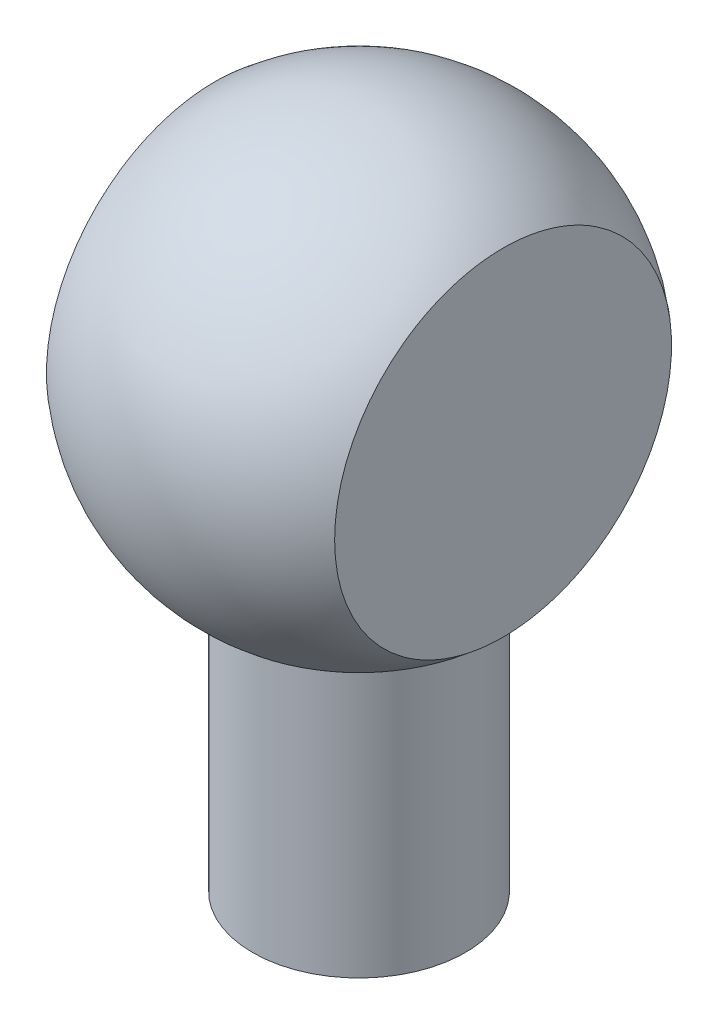
from build123d import *

# Parameters (mm, degrees)
CROQUIS2_W            = 6.49448131
CROQUIS2_H            = 22.918025391
CORTAR_EXTRUIR1_DEPTH = 23


with BuildPart() as part:
    # Croquis1 → Revolución1 (revolve)
    with BuildSketch(Plane(origin=(0, 0, 0), x_dir=(0, 0, -1), z_dir=(1, 0, 0))):
        with BuildLine():
            Line((0, 0), (-4.8, 0))
            Line((-4.8, 0), (-4.8, 12))
            ThreePointArc((-4.8, 12), (-9.688313806, 23.249896135), (0, 30.77268488))
            Line((0, 30.77268488), (0, 0))
        make_face()
    revolve(axis=Axis((0, 20.77268488, 0), (0, -1, 0)))

    # Croquis2 → Cortar-Extruir1 (cut)
    with BuildSketch(Plane(origin=(0, 35, 0), x_dir=(1, 0, 0), z_dir=(0, 1, 0))):
        with Locations((-9.747240655, 0.200573946)):
            Rectangle(CROQUIS2_W, CROQUIS2_H)
        with Locations((9.747240655, 0.200573946)):
            Rectangle(CROQUIS2_W, CROQUIS2_H)
    extrude(amount=-CORTAR_EXTRUIR1_DEPTH, mode=Mode.SUBTRACT)


solid = part.part
